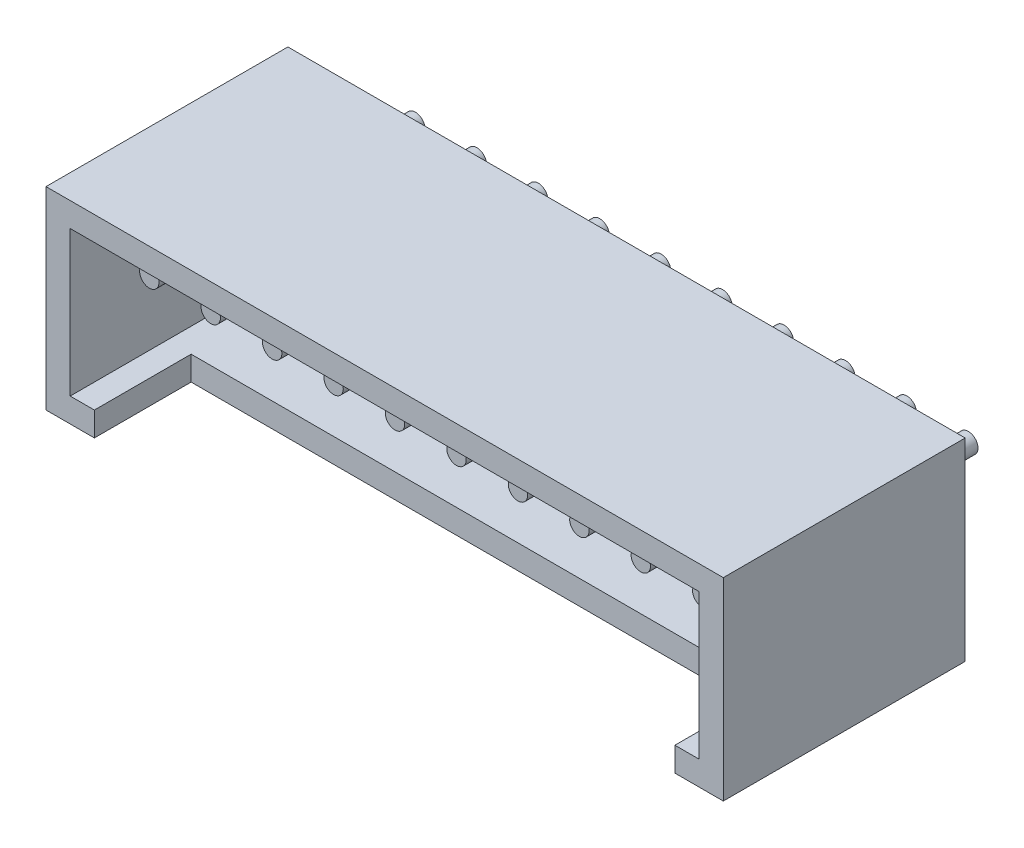
from build123d import *

# Parameters (mm, degrees)
SKETCH_1_W             = 14
SKETCH_1_H             = 4
EXTRUDE_1_DEPTH        = 5
SKETCH_2_W             = 13
SKETCH_2_H             = 3
CUT_EXTRUDE_1_DEPTH    = 3.6
CUT_EXTRUDE_2_REACH    = 17.395
SKETCH_3_W             = 12
SKETCH_3_H             = 3.737461846
SKETCH_4_R             = 0.2
EXTRUDE_2_DEPTH        = 2.75
PATTERN_LINEAR_1_COUNT = 10
PATTERN_LINEAR_1_PITCH = 1.27


with BuildPart() as part:
    # 草图1 → 凸台-拉伸1 (new body)
    with BuildSketch(Plane.XY):
        with Locations((7, 2)):
            Rectangle(SKETCH_1_W, SKETCH_1_H)
    extrude(amount=EXTRUDE_1_DEPTH)

    # 草图2 → 切除-拉伸1 (cut)
    with BuildSketch(Plane.XY.offset(5)):
        with Locations((7, 2)):
            Rectangle(SKETCH_2_W, SKETCH_2_H)
    extrude(amount=-CUT_EXTRUDE_1_DEPTH, mode=Mode.SUBTRACT)

    # 草图3 → 切除-拉伸2 (cut, up to next)
    with BuildSketch(Plane.XZ, mode=Mode.PRIVATE) as cut_extrude_2_sk1:
        with Locations((7, 4.868730923)):
            Rectangle(SKETCH_3_W, SKETCH_3_H)
    cut_extrude_2_tool1 = extrude(cut_extrude_2_sk1.sketch, amount=-CUT_EXTRUDE_2_REACH, mode=Mode.PRIVATE) & part.part
    add(cut_extrude_2_tool1.solids().sort_by_distance((7, 0, 4.868731))[0], mode=Mode.SUBTRACT)

    # 草图4 → 凸台-拉伸2 (add, symmetric)
    with BuildSketch(Plane.XY.offset(1.4)):
        with Locations((1.285, 2.6)):
            Circle(SKETCH_4_R)
    extrude_2 = extrude(amount=EXTRUDE_2_DEPTH, both=True)

    # 阵列(线性)1: 凸台-拉伸2 ×10
    with Locations(*[(i * PATTERN_LINEAR_1_PITCH, 0, 0) for i in range(1, PATTERN_LINEAR_1_COUNT)]):
        add(extrude_2)


solid = part.part
